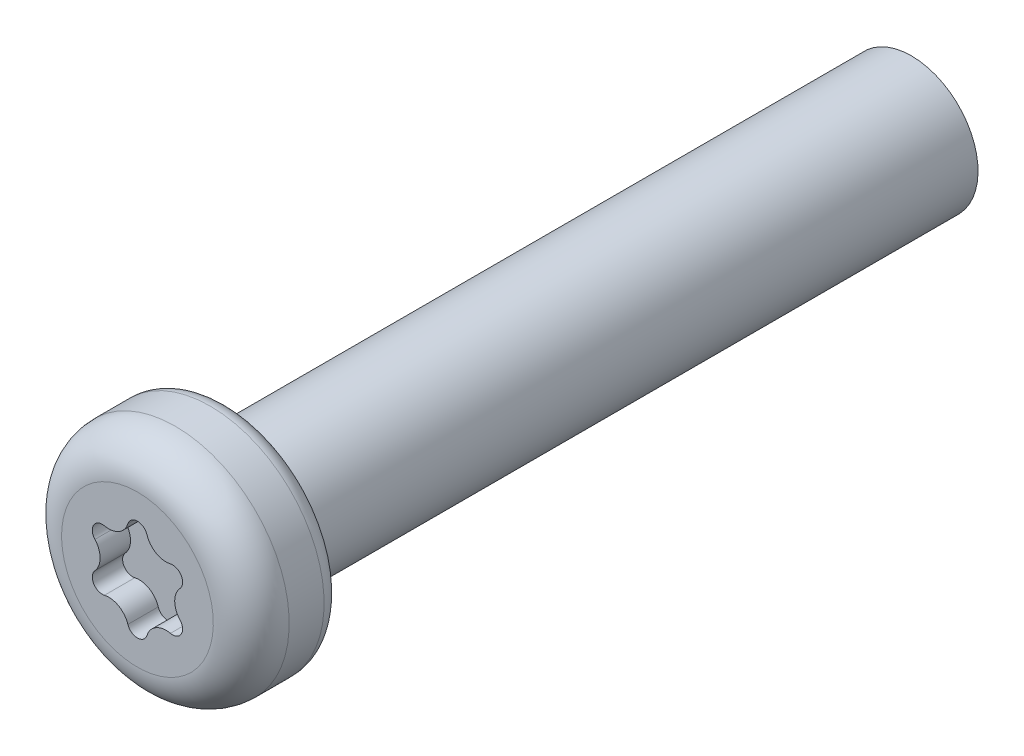
from build123d import *

# Parameters (mm, degrees)
SKETCH17_W         = 12
SKETCH17_H         = 1.17
SKETCH1_R          = 2
EXTRUDE3_DEPTH     = 1.6
CUT_EXTRUDE1_DEPTH = 0.533333333
CIRPATTERN1_COUNT  = 6


with BuildPart() as part:
    # Sketch17 → Revolve1 (revolve)
    with BuildSketch(Plane(origin=(0, 0, 0), x_dir=(0, 0, -1), z_dir=(1, 0, 0))):
        with Locations((6, 0.585)):
            Rectangle(SKETCH17_W, SKETCH17_H)
    revolve(axis=Axis((0, 0, 0), (0, 0, 1)))


with BuildPart() as body_2:
    # Sketch1 → Extrude3 (new body)
    with BuildSketch(Plane.XY):
        Circle(SKETCH1_R)
    extrude(amount=EXTRUDE3_DEPTH)

    # Sketch11 → Cut-Revolve3 (revolve, cut)
    with BuildSketch(Plane(origin=(0, 0, 0), x_dir=(0, 0, -1), z_dir=(1, 0, 0))):
        with BuildLine():
            Line((-0.933333333, 2), (-0.32, 2))
            ThreePointArc((-0.32, 2), (-0.09372583, 1.90627417), (0, 1.68))
            Line((0, 1.68), (0.254, 1.68))
            Line((0.254, 1.68), (0.254, 2.254))
            Line((0.254, 2.254), (-1.854, 2.254))
            Line((-1.854, 2.254), (-1.854, 1.333333333))
            Line((-1.854, 1.333333333), (-1.6, 1.333333333))
            ThreePointArc((-1.6, 1.333333333), (-1.404737854, 1.804737854), (-0.933333333, 2))
        make_face()
    revolve(axis=Axis((0, 0, 0), (0, 0, 1)), mode=Mode.SUBTRACT)

    # Sketch12 → Cut-Extrude1 (cut)
    with BuildSketch(Plane.XY.offset(1.6)):
        with BuildLine():
            Line((-0.327453492, 0.567166085), (0, 0))
            Line((0, 0), (0.327453492, 0.567166085))
            ThreePointArc((0.327453492, 0.567166085), (0.229009756, 0.651587798), (0.167817831, 0.765928268))
            ThreePointArc((0.167817831, 0.765928268), (0, 0.888888889), (-0.167817831, 0.765928268))
            ThreePointArc((-0.167817831, 0.765928268), (-0.229009756, 0.651587798), (-0.327453492, 0.567166085))
        make_face()
    cut_extrude1 = extrude(amount=-CUT_EXTRUDE1_DEPTH, mode=Mode.SUBTRACT)

    # CirPattern1: Cut-Extrude1 ×6 about axis
    cirpattern1_axis = Axis((0, 0, 0), (0, 0, 1))
    for i in range(1, CIRPATTERN1_COUNT):
        add(cut_extrude1.rotate(cirpattern1_axis, i * 360 / CIRPATTERN1_COUNT), mode=Mode.SUBTRACT)

    # Combine1: union part
    add(part.part)


solid = body_2.part
